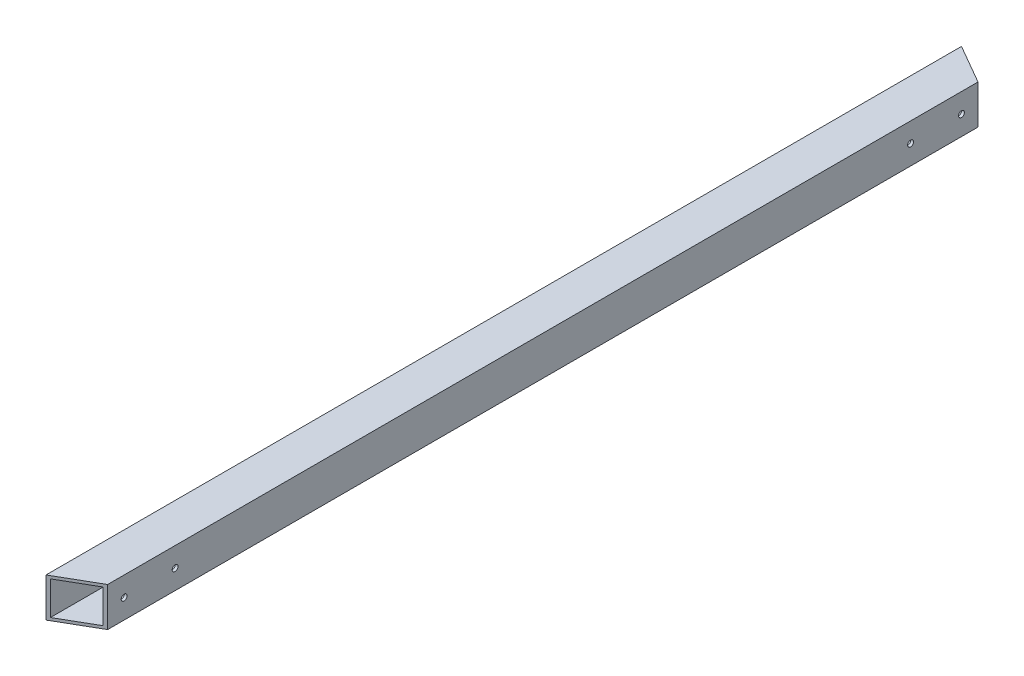
from build123d import *

# Parameters (mm, degrees)
SKETCH1_W           = 44.45
SKETCH1_H           = 44.45
SKETCH1_W_2         = 38.1
SKETCH1_H_2         = 38.1
BOSS_EXTRUDE1_DEPTH = 1041.4
CUT_EXTRUDE2_DEPTH  = 1041.4
SKETCH9_R           = 3.3734375
CUT_EXTRUDE3_DEPTH  = 1043.585110734


with BuildPart() as part:
    # Sketch1 → Boss-Extrude1 (new body)
    with BuildSketch(Plane.XY):
        Rectangle(SKETCH1_W, SKETCH1_H)
        Rectangle(SKETCH1_W_2, SKETCH1_H_2, mode=Mode.SUBTRACT)
    extrude(amount=BOSS_EXTRUDE1_DEPTH)

    # Sketch2 → Cut-Extrude2 (cut)
    with BuildSketch(Plane(origin=(0, 22.225, 0), x_dir=(1, 0, 0), z_dir=(0, 1, 0))):
        Polygon((-22.225, -1041.4), (22.225, -1041.4), (22.225, -1015.736780535), align=None)
        Polygon((-22.225, 0), (22.225, -25.663219465), (22.225, 0), align=None)
    extrude(amount=-CUT_EXTRUDE2_DEPTH, mode=Mode.SUBTRACT)

    # Sketch9 → Cut-Extrude3 (cut, through all)
    with BuildSketch(Plane.ZY.offset(22.225)):
        with Locations((996.95, 0)):
            Circle(SKETCH9_R)
        with Locations((44.45, 0)):
            Circle(SKETCH9_R)
        with Locations((102.389658314, 0)):
            Circle(SKETCH9_R)
        with Locations((939.010341686, 0)):
            Circle(SKETCH9_R)
    extrude(amount=-CUT_EXTRUDE3_DEPTH, mode=Mode.SUBTRACT)


solid = part.part
